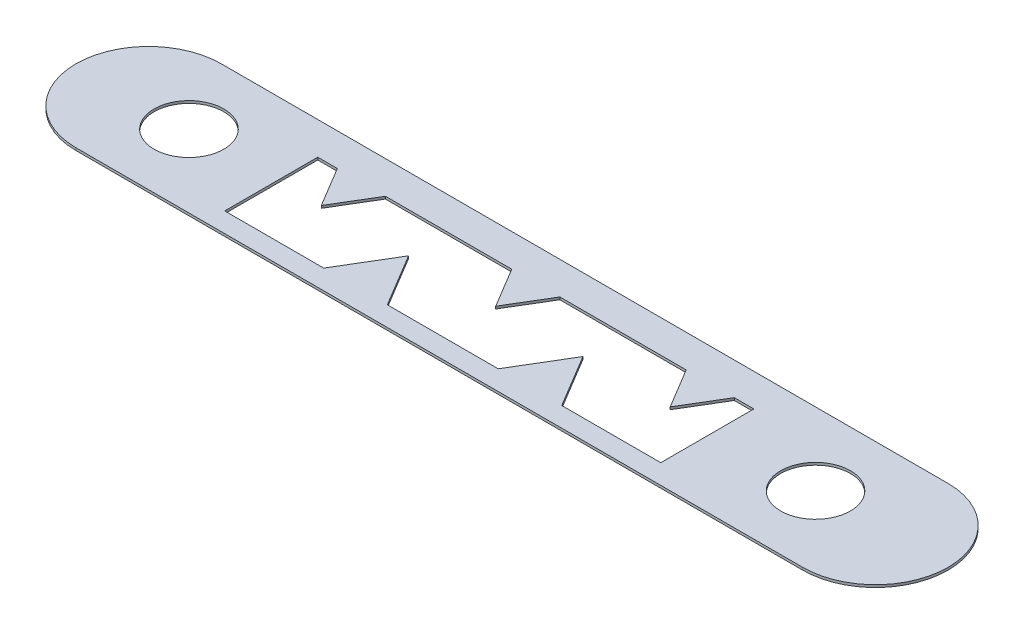
from build123d import *

# Parameters (mm, degrees)
SKETCH1_R           = 12
BOSS_EXTRUDE1_DEPTH = 0.85


with BuildPart() as part:
    # Sketch1 → Boss-Extrude1 (new body)
    # profile 1 of 9: a face of its own
    with BuildSketch(Plane(origin=(0, 0, 0), x_dir=(1, 0, 0), z_dir=(0, 1, 0))):
        Polygon((103.091739333, 32.005343302), (86.560327372, 32.005343302), (94.826033353, 18.229166667), align=None)
    # profile 2 of 9: a face of its own
    with BuildSketch(Plane(origin=(0, 0, 0), x_dir=(1, 0, 0), z_dir=(0, 1, 0))):
        Polygon((124.826033353, 18.229166667), (113.888533353, 0), (135.763533353, 0), align=None)
    # profile 3 of 9: a face of its own
    with BuildSketch(Plane(origin=(0, 0, 0), x_dir=(1, 0, 0), z_dir=(0, 1, 0))):
        Polygon((163.091739333, 32.005343302), (146.560327372, 32.005343302), (154.826033353, 18.229166667), align=None)
    # profile 4 of 9: a face of its own
    with BuildSketch(Plane(origin=(0, 0, 0), x_dir=(1, 0, 0), z_dir=(0, 1, 0))):
        Polygon((173.888533353, 0), (195.763533353, 0), (184.826033353, 18.229166667), align=None)
    # profile 5 of 9: a face of its own
    with BuildSketch(Plane(origin=(0, 0, 0), x_dir=(1, 0, 0), z_dir=(0, 1, 0))):
        Polygon((214.826033353, 18.229166667), (223.091739333, 32.005343302), (206.560327372, 32.005343302), align=None)
    # profile 6 of 9: a face of its own
    with BuildSketch(Plane(origin=(0, 0, 0), x_dir=(1, 0, 0), z_dir=(0, 1, 0))):
        Polygon((229.826033353, 43.229166667), (79.826033353, 43.229166667), (79.826033353, 32.005343302), (86.560327372, 32.005343302), (103.091739333, 32.005343302), (109.826033353, 32.005343302), (116.560327372, 32.005343302), (133.091739333, 32.005343302), (139.826033353, 32.005343302), (146.560327372, 32.005343302), (163.091739333, 32.005343302), (169.826033353, 32.005343302), (176.560327372, 32.005343302), (193.091739333, 32.005343302), (199.826033353, 32.005343302), (206.560327372, 32.005343302), (223.091739333, 32.005343302), (229.826033353, 32.005343302), align=None)
    # profile 7 of 9: a face of its own
    with BuildSketch(Plane(origin=(0, 0, 0), x_dir=(1, 0, 0), z_dir=(0, 1, 0))):
        Polygon((79.826033353, 0), (79.826033353, -6.770833333), (229.826033353, -6.770833333), (229.826033353, 0), (225.763533353, 0), (203.888533353, 0), (199.826033353, 0), (195.763533353, 0), (173.888533353, 0), (169.826033353, 0), (165.763533353, 0), (143.888533353, 0), (139.826033353, 0), (135.763533353, 0), (113.888533353, 0), (109.826033353, 0), (105.763533353, 0), (83.888533353, 0), align=None)
    # profile 8 of 9: a face of its own
    with BuildSketch(Plane(origin=(0, 0, 0), x_dir=(1, 0, 0), z_dir=(0, 1, 0))):
        with BuildLine():
            Line((79.826033353, 43.229166667), (35.416666667, 43.229166667))
            ThreePointArc((35.416666667, 43.229166667), (10.416666667, 18.229166667), (35.416666667, -6.770833333))
            Line((35.416666667, -6.770833333), (79.826033353, -6.770833333))
            Line((79.826033353, -6.770833333), (79.826033353, 0))
            Line((79.826033353, 0), (79.826033353, 32.005343302))
            Line((79.826033353, 32.005343302), (79.826033353, 43.229166667))
        make_face()
        with Locations(Location((49.297410929, 18.229166667, 0), (0, 0, 270))):
            Circle(SKETCH1_R, mode=Mode.SUBTRACT)
    # profile 9 of 9: a face of its own
    with BuildSketch(Plane(origin=(0, 0, 0), x_dir=(1, 0, 0), z_dir=(0, 1, 0))):
        with BuildLine():
            Line((285.416666667, 43.229166667), (229.826033353, 43.229166667))
            Line((229.826033353, 43.229166667), (229.826033353, 32.005343302))
            Line((229.826033353, 32.005343302), (229.826033353, 0))
            Line((229.826033353, 0), (229.826033353, -6.770833333))
            Line((229.826033353, -6.770833333), (285.416666667, -6.770833333))
            ThreePointArc((285.416666667, -6.770833333), (310.416666667, 18.229166667), (285.416666667, 43.229166667))
        make_face()
        with Locations(Location((264.825532318, 18.229166667, 0), (0, 0, 270))):
            Circle(SKETCH1_R, mode=Mode.SUBTRACT)
    extrude(amount=BOSS_EXTRUDE1_DEPTH)


solid = part.part
